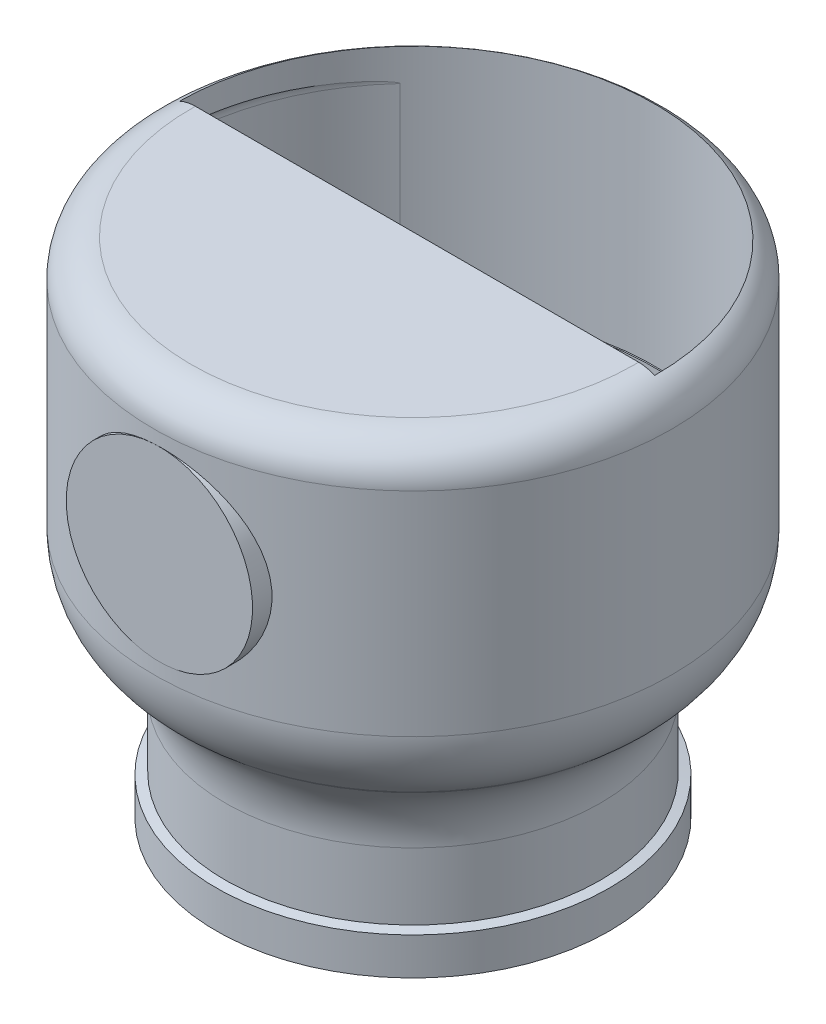
from build123d import *
from build123d.topology import SkipClean

# Parameters (mm, degrees)
CUT_EXTRUDE2_DEPTH  = 25
SKETCH10_R          = 10
BOSS_EXTRUDE1_DEPTH = 5
CUT_EXTRUDE3_DEPTH  = 10


with BuildPart() as part:
    # Sketch1 → Revolve1 (revolve)
    with BuildSketch(Plane.XY):
        with BuildLine():
            Line((20.9, 0), (23.871591838, 0))
            Line((23.871591838, 0), (23.871591838, 4))
            Line((23.871591838, 4), (22.9, 4.236662843))
            Line((22.9, 4.236662843), (22.9, 11.404308102))
            ThreePointArc((22.9, 11.404308102), (23.83692213, 15.63049072), (26.472123903, 19.064752533))
            Line((26.472123903, 19.064752533), (26.988320528, 19.497892931))
            ThreePointArc((26.988320528, 19.497892931), (29.623522302, 22.932154745), (30.560444431, 27.158337362))
            Line((30.560444431, 27.158337362), (30.560444431, 50))
            ThreePointArc((30.560444431, 50), (29.388871556, 52.828427125), (26.560444431, 54))
            Line((26.560444431, 54), (2.764914955, 54))
            Line((2.764914955, 54), (2.764914955, 52))
            Line((2.764914955, 52), (26.560444431, 52))
            ThreePointArc((26.560444431, 52), (27.974657994, 51.414213562), (28.560444431, 50))
            Line((28.560444431, 50), (28.560444431, 28.090952678))
            ThreePointArc((28.560444431, 28.090952678), (27.623522302, 23.864770061), (24.988320528, 20.430508247))
            Line((24.988320528, 20.430508247), (23.688173754, 19.339555569))
            ThreePointArc((23.688173754, 19.339555569), (20.680499091, 17.603073792), (17.260297657, 17))
            Line((17.260297657, 17), (2.764914955, 17))
            Line((2.764914955, 17), (2.764914955, 15))
            Line((2.764914955, 15), (19.9, 15))
            ThreePointArc((19.9, 15), (20.607106781, 14.707106781), (20.9, 14))
            Line((20.9, 14), (20.9, 0))
        make_face()
    revolve(axis=Axis((2.764914955, 7.821821657, 0), (0, 1, 0)))

    # Sketch9 → Cut-Extrude2 (cut)
    with BuildSketch(Plane(origin=(0, 54, 0), x_dir=(1, 0, 0), z_dir=(0, 1, 0))):
        with BuildLine():
            Line((-22.735085045, 0.437631804), (28.264914955, 0.437631804))
            ThreePointArc((28.264914955, 0.437631804), (2.764914955, 25.937631804), (-22.735085045, 0.437631804))
        make_face()
    extrude(amount=-CUT_EXTRUDE2_DEPTH, mode=Mode.SUBTRACT)

    # Sketch10 → Boss-Extrude1 (add)
    with SkipClean():  # the faces are left unmerged after this step: merging them gives an invalid solid
        with BuildSketch(Plane.XY.offset(27.795529476)):
            with Locations((3.346345887, 38.658337362)):
                Circle(SKETCH10_R)
        extrude(amount=-BOSS_EXTRUDE1_DEPTH)

    # Sketch11 → Cut-Extrude3 (cut)
    with SkipClean():  # the faces are left unmerged after this step: merging them gives an invalid solid
        with BuildSketch(Plane(origin=(0, 17, 0), x_dir=(1, 0, 0), z_dir=(0, 1, 0))):
            with BuildLine():
                Line((-11.730467747, 0), (17.260297657, 0))
                ThreePointArc((17.260297657, 0), (2.764914955, 14.495382702), (-11.730467747, 0))
            make_face()
        extrude(amount=-CUT_EXTRUDE3_DEPTH, mode=Mode.SUBTRACT)


solid = part.part
